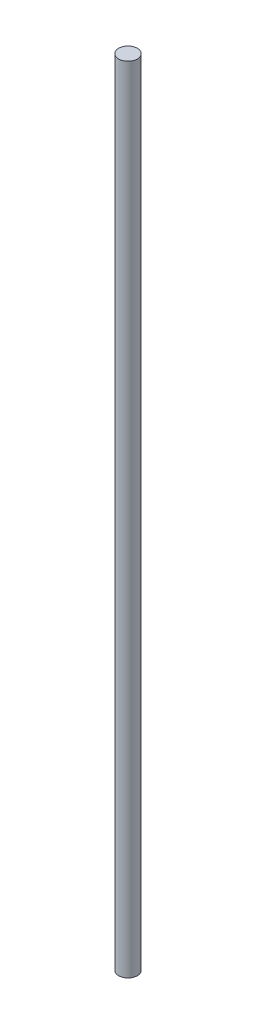
from build123d import *

# Parameters (mm, degrees)
BOSS_EXTRUDE1_DEPTH      = 170
BOSS_EXTRUDE1_DEPTH_BACK = 170
SKETCH1_R                = 4


with BuildPart() as part:
    # Sketch1 → Boss-Extrude1 (new, two sides: drawn at the far end of the back side and taken through both)
    with BuildSketch(Plane(origin=(0, 0, 0), x_dir=(1, 0, 0), z_dir=(0, 1, 0)).offset(-BOSS_EXTRUDE1_DEPTH_BACK)):
        with Locations(Location((0, 0, 0), (0, 0, 270))):
            Circle(SKETCH1_R)
    extrude(amount=BOSS_EXTRUDE1_DEPTH + BOSS_EXTRUDE1_DEPTH_BACK)


solid = part.part
